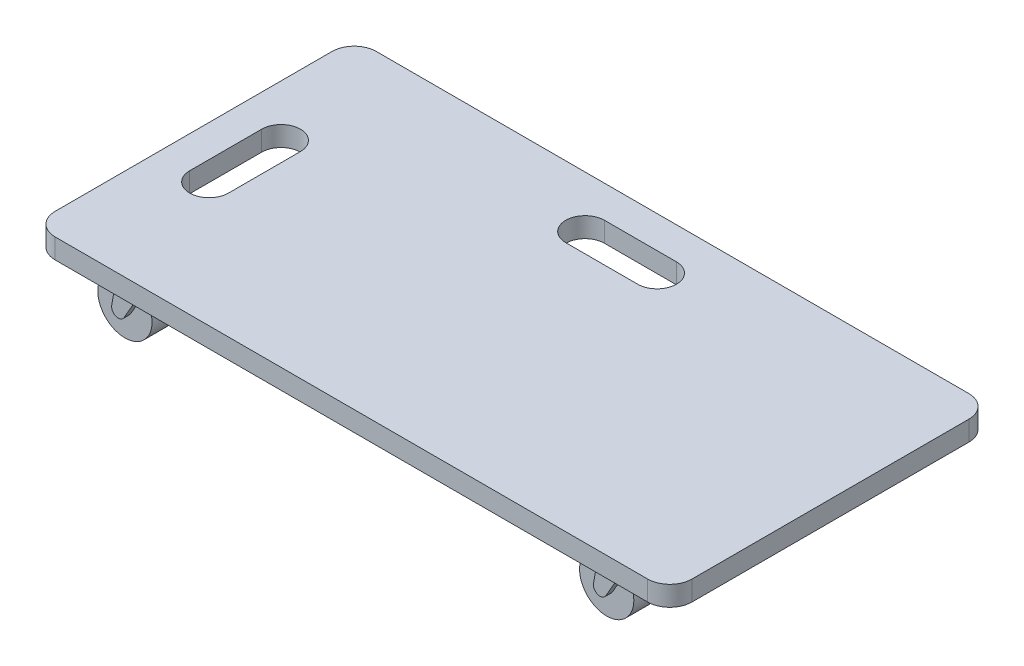
from build123d import *

# Parameters (mm, degrees)
ESQUISSE1_W                  = 575
ESQUISSE1_H                  = 290
BOSS_EXTRU_1_DEPTH           = 18
CONG_1_R                     = 20
ESQUISSE2_R                  = 17.5
BOSS_EXTRU_2_DEPTH           = 18
BOSS_EXTRU_3_START           = 100
BOSS_EXTRU_3_DEPTH           = 16
BOSS_EXTRU_4_START           = 100
ESQUISSE4_R                  = 24.5
BOSS_EXTRU_4_DEPTH           = 10
R_P_TITION_LIN_AIRE1_COUNT   = 2
R_P_TITION_LIN_AIRE1_PITCH   = 435
R_P_TITION_LIN_AIRE1_2_COUNT = 2
R_P_TITION_LIN_AIRE1_2_PITCH = 200


with BuildPart() as part:
    # Esquisse1 → Boss.-Extru.1 (new body)
    with BuildSketch(Plane(origin=(0, 0, 0), x_dir=(1, 0, 0), z_dir=(0, 1, 0))):
        Rectangle(ESQUISSE1_W, ESQUISSE1_H)
        with BuildLine():
            Line((-223.5, 32.5), (-223.5, -32.5))
            ThreePointArc((-223.5, -32.5), (-241, -50), (-258.5, -32.5))
            Line((-258.5, -32.5), (-258.5, 32.5))
            ThreePointArc((-258.5, 32.5), (-241, 50), (-223.5, 32.5))
        make_face(mode=Mode.SUBTRACT)
        with BuildLine():
            Line((-32.5, 116), (32.5, 116))
            ThreePointArc((32.5, 116), (50, 98.5), (32.5, 81))
            Line((32.5, 81), (-32.5, 81))
            ThreePointArc((-32.5, 81), (-50, 98.5), (-32.5, 116))
        make_face(mode=Mode.SUBTRACT)
    extrude(amount=-BOSS_EXTRU_1_DEPTH)

    # Congé1
    cong_1_edges = [part.edges().sort_by_distance(p)[0] for p in [
        (287.5, -9, 145),
        (-287.5, -9, 145),
        (-287.5, -9, -145),
        (287.5, -9, -145),
    ]]
    fillet(cong_1_edges, radius=CONG_1_R)


with BuildPart() as body_2:
    # Esquisse2 → Boss.-Extru.2 (new body)
    with BuildSketch(Plane.XZ.offset(18)):
        with Locations(Location((-217.5, 100, 0), (0, 0, 270))):
            Circle(ESQUISSE2_R)
    extrude(amount=BOSS_EXTRU_2_DEPTH)

    # Esquisse3 → Boss.-Extru.3 (add, symmetric)
    with BuildSketch(Plane.XY.offset(BOSS_EXTRU_3_START)):
        with BuildLine():
            Line((-245.408846518, -56.958110934), (-239.421115347, -23))
            Line((-239.421115347, -23), (-212.364537348, -23))
            Line((-212.364537348, -23), (-234.303847577, -61))
            ThreePointArc((-234.303847577, -61), (-241.55212086, -63.638155725), (-245.408846518, -56.958110934))
        make_face()
    extrude(amount=BOSS_EXTRU_3_DEPTH, both=True)


with BuildPart() as body_3:
    # Esquisse4 → Boss.-Extru.4 (new, symmetric)
    with BuildSketch(Plane.XY.offset(BOSS_EXTRU_4_START)):
        with Locations((-239.5, -58)):
            Circle(ESQUISSE4_R)
    extrude(amount=BOSS_EXTRU_4_DEPTH, both=True)


with BuildPart() as r_p_tition_lin_aire1_1:
    # Répétition linéaire1: pattern copy
    add(body_3.part.moved(Location(Vector(1, 0, 0) * (1 * R_P_TITION_LIN_AIRE1_PITCH))))


with BuildPart() as r_p_tition_lin_aire1_2:
    # Répétition linéaire1: pattern copy
    add(body_2.part.moved(Location(Vector(1, 0, 0) * (1 * R_P_TITION_LIN_AIRE1_PITCH))))


with BuildPart() as r_p_tition_lin_aire1_2_1:
    # R_p_tition lin_aire1 2: pattern copy
    add(body_3.part.moved(Location(Vector(0, 0, -1) * (1 * R_P_TITION_LIN_AIRE1_2_PITCH))))


with BuildPart() as r_p_tition_lin_aire1_2_2:
    # R_p_tition lin_aire1 2: pattern copy
    add(body_2.part.moved(Location(Vector(0, 0, -1) * (1 * R_P_TITION_LIN_AIRE1_2_PITCH))))


with BuildPart() as r_p_tition_lin_aire1_2_3:
    # R_p_tition lin_aire1 2: pattern copy
    add(r_p_tition_lin_aire1_1.part.moved(Location(Vector(0, 0, -1) * (1 * R_P_TITION_LIN_AIRE1_2_PITCH))))


with BuildPart() as r_p_tition_lin_aire1_2_4:
    # R_p_tition lin_aire1 2: pattern copy
    add(r_p_tition_lin_aire1_2.part.moved(Location(Vector(0, 0, -1) * (1 * R_P_TITION_LIN_AIRE1_2_PITCH))))


solid = Compound([part.part, body_2.part, body_3.part, r_p_tition_lin_aire1_1.part, r_p_tition_lin_aire1_2.part, r_p_tition_lin_aire1_2_1.part, r_p_tition_lin_aire1_2_2.part, r_p_tition_lin_aire1_2_3.part, r_p_tition_lin_aire1_2_4.part])
